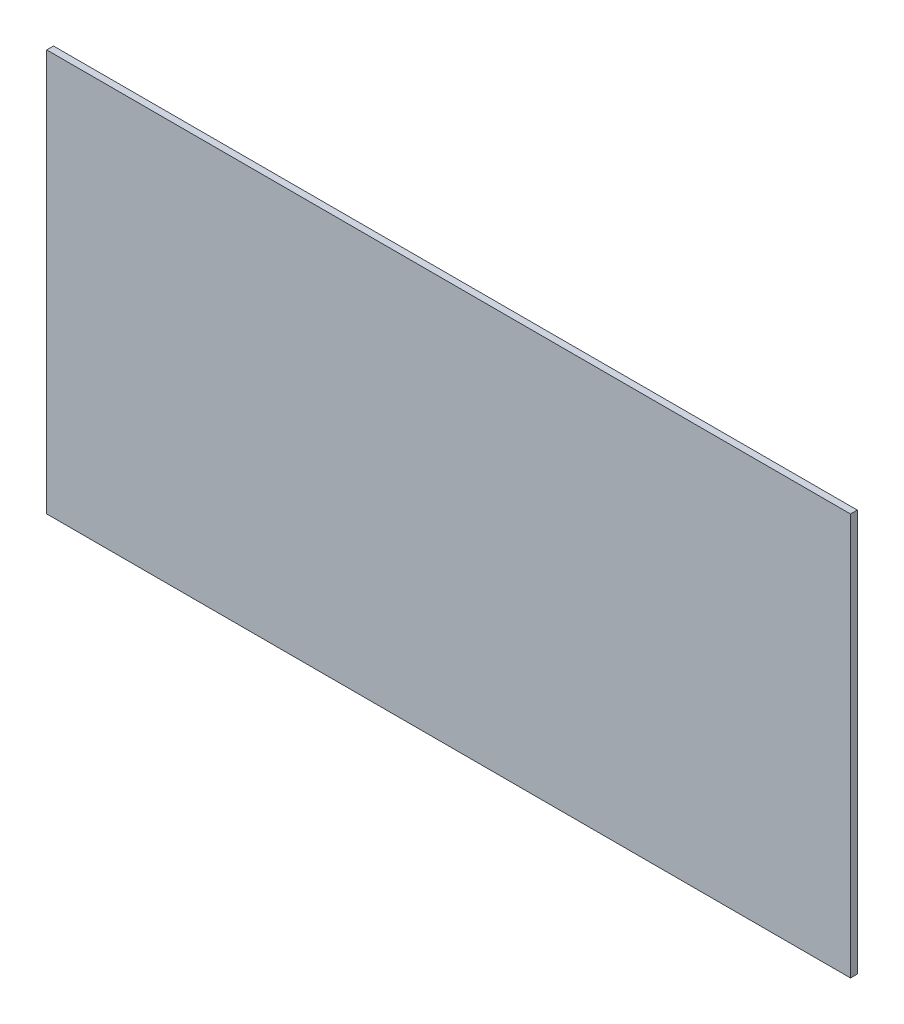
from build123d import *

# Parameters (mm, degrees)
ESQUISSE1_W        = 356
ESQUISSE1_H        = 178
BOSS_EXTRU_1_DEPTH = 3


with BuildPart() as part:
    # Esquisse1 → Boss.-Extru.1 (new body)
    with BuildSketch(Plane.XY):
        with Locations((43.328947368, 29.861842105)):
            Rectangle(ESQUISSE1_W, ESQUISSE1_H)
    extrude(amount=BOSS_EXTRU_1_DEPTH)


solid = part.part
